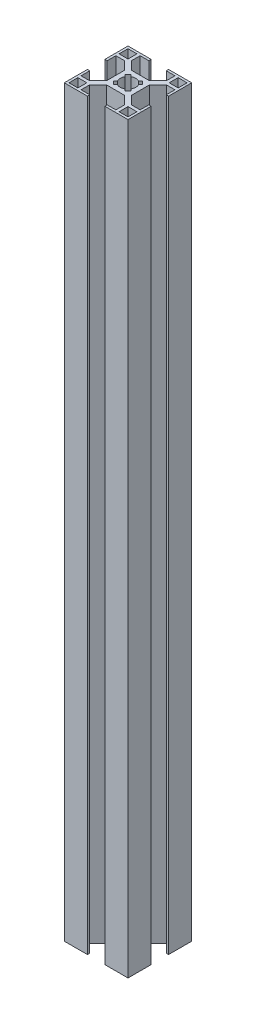
from build123d import *

# Parameters (mm, degrees)
CROQUIS2_W              = 4.2
CROQUIS2_H              = 4.2
SALIENTE_EXTRUIR1_DEPTH = 350


with BuildPart() as part:
    # Croquis2 → Saliente-Extruir1 (new body)
    with BuildSketch(Plane(origin=(0, 0, 0), x_dir=(1, 0, 0), z_dir=(0, 1, 0))):
        Polygon((-37.373217156, 24.271112291), (-26.498217156, 24.271112291), (-26.498217156, 23.171112291), (-30.573217156, 23.171112291), (-30.573217156, 19.168168566), (-26.586160881, 15.181112291), (-18.160273431, 15.181112291), (-14.173217156, 19.168168566), (-14.173217156, 23.171112291), (-18.248217156, 23.171112291), (-18.248217156, 24.271112291), (-7.373217156, 24.271112291), (-7.373217156, 13.396112291), (-8.473217156, 13.396112291), (-8.473217156, 17.471112291), (-12.476160881, 17.471112291), (-16.463217156, 13.484056016), (-16.463217156, 5.058168566), (-12.476160881, 1.071112291), (-8.473217156, 1.071112291), (-8.473217156, 5.146112291), (-7.373217156, 5.146112291), (-7.373217156, -5.728887709), (-18.248217156, -5.728887709), (-18.248217156, -4.628887709), (-14.173217156, -4.628887709), (-14.173217156, -0.625943984), (-18.160273431, 3.361112291), (-26.586160881, 3.361112291), (-30.573217156, -0.625943984), (-30.573217156, -4.628887709), (-26.498217156, -4.628887709), (-26.498217156, -5.728887709), (-37.373217156, -5.728887709), (-37.373217156, 5.146112291), (-36.273217156, 5.146112291), (-36.273217156, 1.071112291), (-32.270273431, 1.071112291), (-28.283217156, 5.058168566), (-28.283217156, 13.484056016), (-32.270273431, 17.471112291), (-36.273217156, 17.471112291), (-36.273217156, 13.396112291), (-37.373217156, 13.396112291), align=None)
        with Locations((-10.573217156, 21.071112291)):
            Rectangle(CROQUIS2_W, CROQUIS2_H, mode=Mode.SUBTRACT)
        with Locations((-34.173217156, -2.528887709)):
            Rectangle(CROQUIS2_W, CROQUIS2_H, mode=Mode.SUBTRACT)
        with Locations((-34.173217156, 21.071112291)):
            Rectangle(CROQUIS2_W, CROQUIS2_H, mode=Mode.SUBTRACT)
        with Locations((-10.573217156, -2.528887709)):
            Rectangle(CROQUIS2_W, CROQUIS2_H, mode=Mode.SUBTRACT)
        with BuildLine():
            Line((-19.165547938, 11.064567946), (-18.248217156, 11.981898728))
            Line((-18.248217156, 11.981898728), (-19.662430718, 13.396112291))
            Line((-19.662430718, 13.396112291), (-20.5797615, 12.478781509))
            ThreePointArc((-20.5797615, 12.478781509), (-22.373217156, 12.946112291), (-24.166672811, 12.478781509))
            Line((-24.166672811, 12.478781509), (-25.084003593, 13.396112291))
            Line((-25.084003593, 13.396112291), (-26.498217156, 11.981898728))
            Line((-26.498217156, 11.981898728), (-25.580886374, 11.064567946))
            ThreePointArc((-25.580886374, 11.064567946), (-26.048217156, 9.271112291), (-25.580886374, 7.477656635))
            Line((-25.580886374, 7.477656635), (-26.498217156, 6.560325853))
            Line((-26.498217156, 6.560325853), (-25.084003593, 5.146112291))
            Line((-25.084003593, 5.146112291), (-24.166672811, 6.063443073))
            ThreePointArc((-24.166672811, 6.063443073), (-22.373217156, 5.596112291), (-20.5797615, 6.063443073))
            Line((-20.5797615, 6.063443073), (-19.662430718, 5.146112291))
            Line((-19.662430718, 5.146112291), (-18.248217156, 6.560325853))
            Line((-18.248217156, 6.560325853), (-19.165547938, 7.477656635))
            ThreePointArc((-19.165547938, 7.477656635), (-18.698217156, 9.271112291), (-19.165547938, 11.064567946))
        make_face(mode=Mode.SUBTRACT)
    extrude(amount=SALIENTE_EXTRUIR1_DEPTH)


solid = part.part
